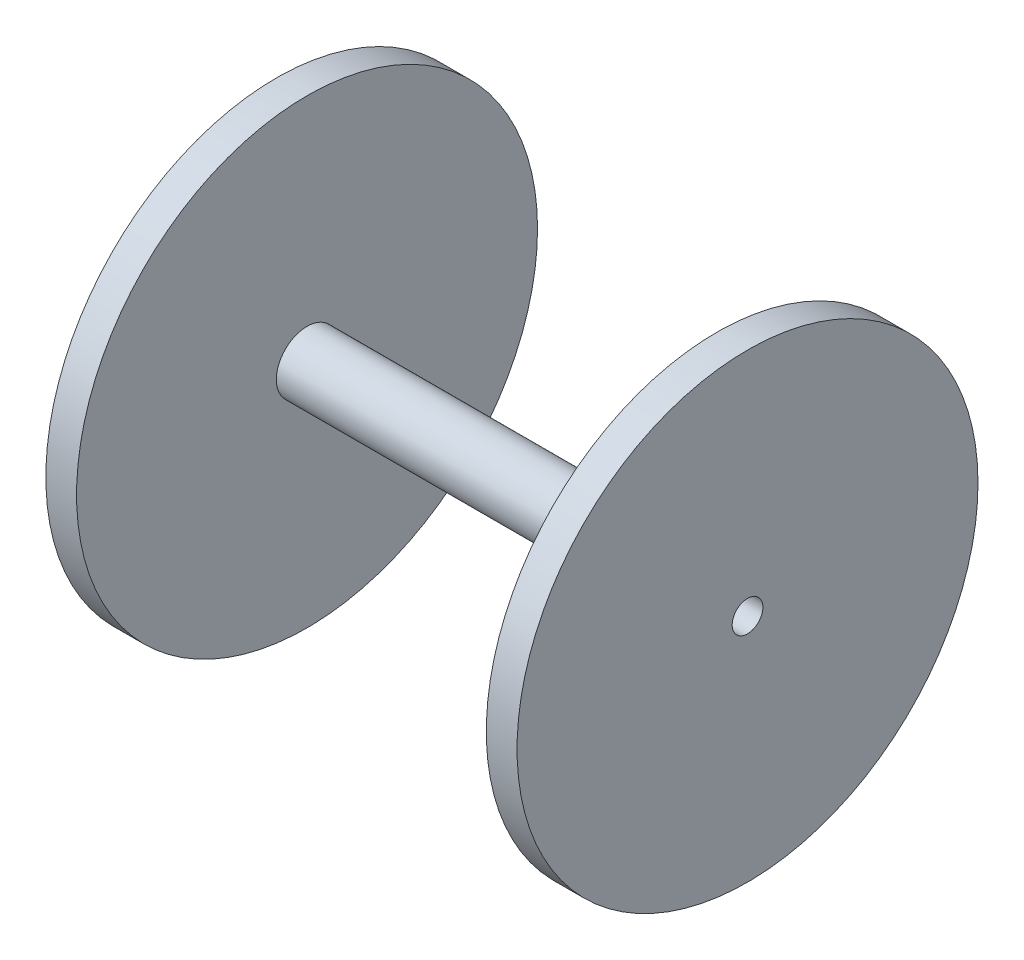
from build123d import *

# Parameters (mm, degrees)
SKETCH1_R           = 3
SKETCH1_R_2         = 1.5
BOSS_EXTRUDE1_DEPTH = 40
SKETCH2_R           = 22.5
SKETCH2_R_2         = 1.5
BOSS_EXTRUDE2_DEPTH = 3
BOSS_EXTRUDE4_DEPTH = 10


with BuildPart() as part:
    # Sketch1 → Boss-Extrude1 (new body)
    with BuildSketch(Plane(origin=(0, 0, 0), x_dir=(0, 0, -1), z_dir=(1, 0, 0))):
        Circle(SKETCH1_R)
        Circle(SKETCH1_R_2, mode=Mode.SUBTRACT)
    extrude(amount=BOSS_EXTRUDE1_DEPTH)

    # Sketch2 → Boss-Extrude2 (add)
    with BuildSketch(Plane(origin=(40, 0, 0), x_dir=(0, 0, -1), z_dir=(1, 0, 0))):
        Circle(SKETCH2_R)
        Circle(SKETCH2_R_2, mode=Mode.SUBTRACT)
    boss_extrude2 = extrude(amount=BOSS_EXTRUDE2_DEPTH)

    # Mirror1: Boss-Extrude2 across plane
    add(boss_extrude2.mirror(Plane(origin=(20, 0, 0), x_dir=(0, 0, 1), z_dir=(1, 0, 0))))

    # Sketch4 → Boss-Extrude4 (add)
    with BuildSketch(Plane.ZY.offset(3)):
        with BuildLine():
            Line((-1, 1.118033989), (-1, -1.118033989))
            ThreePointArc((-1, -1.118033989), (-1.5, 0), (-1, 1.118033989))
        make_face()
    extrude(amount=-BOSS_EXTRUDE4_DEPTH)


solid = part.part
